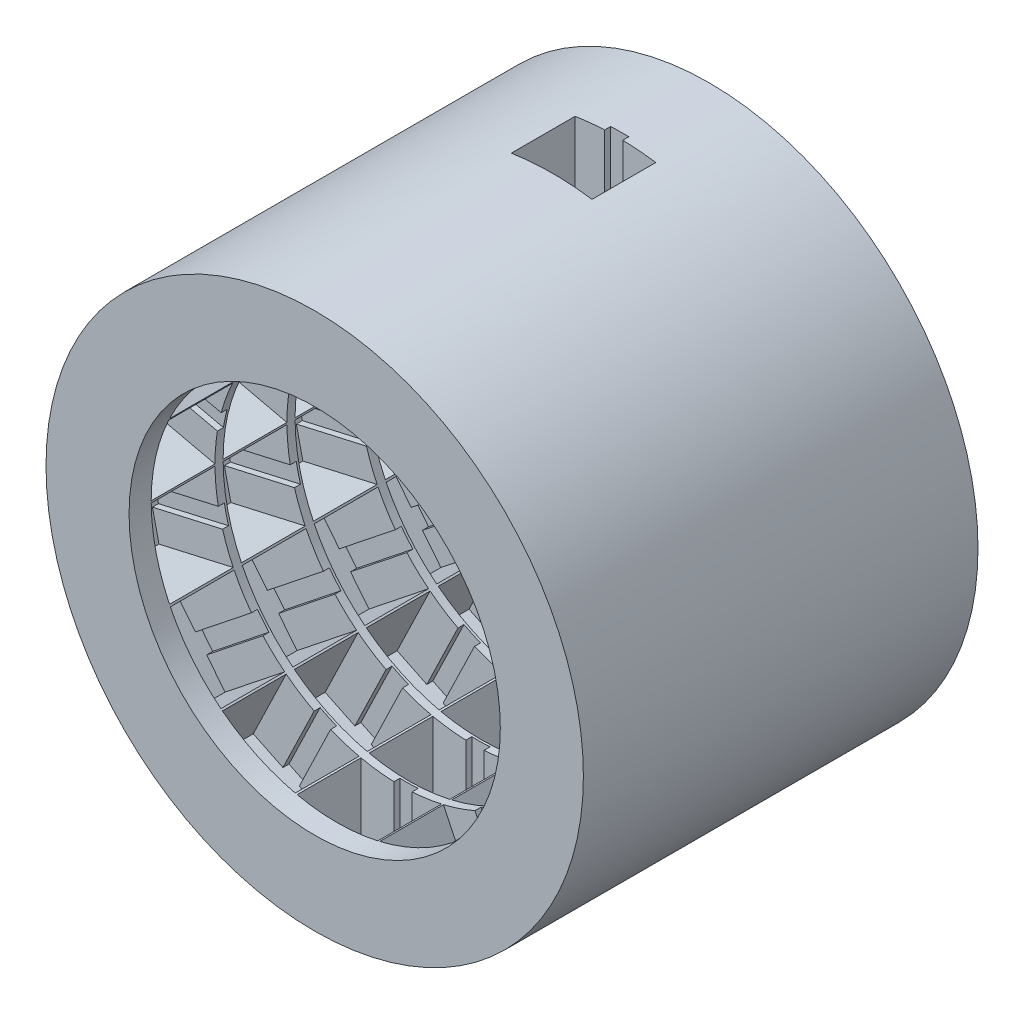
from build123d import *

# Parameters (mm, degrees)
SKETCH1_R               = 2054.325949891
SKETCH1_R_2             = 1419.272954059
BOSS_EXTRUDE1_DEPTH     = 3017
CUT_EXTRUDE1_DEPTH      = 769
CIRPATTERN1_COUNT       = 14
CIRPATTERN1_ANGLE       = 334.1
LPATTERN1_COUNT         = 2
LPATTERN1_PITCH         = 550
LPATTERN1_COPY_1_DEPTH  = 769
LPATTERN1_COPY_2_DEPTH  = 769
LPATTERN1_COPY_3_DEPTH  = 769
LPATTERN1_COPY_4_DEPTH  = 769
LPATTERN1_COPY_5_DEPTH  = 769
LPATTERN1_COPY_6_DEPTH  = 769
LPATTERN1_COPY_7_DEPTH  = 769
LPATTERN1_COPY_8_DEPTH  = 769
LPATTERN1_COPY_9_DEPTH  = 769
LPATTERN1_COPY_10_DEPTH = 769
LPATTERN1_COPY_11_DEPTH = 769
LPATTERN1_COPY_12_DEPTH = 769
LPATTERN1_COPY_13_DEPTH = 769
LPATTERN2_COUNT         = 4
LPATTERN2_PITCH         = 550
LPATTERN2_COPY_1_DEPTH  = 769
LPATTERN2_COPY_2_DEPTH  = 769
LPATTERN2_COPY_3_DEPTH  = 769
LPATTERN2_COPY_4_DEPTH  = 769
LPATTERN2_COPY_5_DEPTH  = 769
LPATTERN2_COPY_6_DEPTH  = 769
LPATTERN2_COPY_7_DEPTH  = 769
LPATTERN2_COPY_8_DEPTH  = 769
LPATTERN2_COPY_9_DEPTH  = 769
LPATTERN2_COPY_10_DEPTH = 769
LPATTERN2_COPY_11_DEPTH = 769
LPATTERN2_COPY_12_DEPTH = 769
LPATTERN2_COPY_13_DEPTH = 769
LPATTERN2_COPY_14_DEPTH = 769
LPATTERN2_COPY_15_DEPTH = 769
LPATTERN2_COPY_16_DEPTH = 769
LPATTERN2_COPY_17_DEPTH = 769
LPATTERN2_COPY_18_DEPTH = 769
LPATTERN2_COPY_19_DEPTH = 769
LPATTERN2_COPY_20_DEPTH = 769
LPATTERN2_COPY_21_DEPTH = 769
LPATTERN2_COPY_22_DEPTH = 769
LPATTERN2_COPY_23_DEPTH = 769
LPATTERN2_COPY_24_DEPTH = 769
LPATTERN2_COPY_25_DEPTH = 769
LPATTERN2_COPY_26_DEPTH = 769
LPATTERN2_COPY_27_DEPTH = 769
LPATTERN2_COPY_28_DEPTH = 769
LPATTERN2_COPY_29_DEPTH = 769
LPATTERN2_COPY_30_DEPTH = 769
LPATTERN2_COPY_31_DEPTH = 769
LPATTERN2_COPY_32_DEPTH = 769
LPATTERN2_COPY_33_DEPTH = 769
LPATTERN2_COPY_34_DEPTH = 769
LPATTERN2_COPY_35_DEPTH = 769
LPATTERN2_COPY_36_DEPTH = 769
LPATTERN2_COPY_37_DEPTH = 769
LPATTERN2_COPY_38_DEPTH = 769
LPATTERN2_COPY_39_DEPTH = 769
CUT_EXTRUDE4_DEPTH      = 1203


with BuildPart() as part:
    # Sketch1 → Boss-Extrude1 (new body)
    with BuildSketch(Plane.XY.offset(943.510776168)):
        with Locations((833.930631376, -1197.16637306)):
            Circle(SKETCH1_R)
        with Locations((833.930631376, -1197.16637306)):
            Circle(SKETCH1_R_2, mode=Mode.SUBTRACT)
    extrude(amount=BOSS_EXTRUDE1_DEPTH)

    # Sketch2 → Cut-Extrude1 (cut)
    with BuildSketch(Plane(origin=(0, 0, 0), x_dir=(1, 0, 0), z_dir=(0, 1, 0))):
        Polygon((1134.867510242, -1653.688224658), (882.617138286, -1653.688224658), (882.617138286, -1607.727014975), (743.684190589, -1607.727014975), (743.684190589, -1653.688224658), (518.159541103, -1653.688224658), (518.159541103, -2141.409900314), (1134.867510242, -2141.409900314), align=None)
    cut_extrude1 = extrude(amount=CUT_EXTRUDE1_DEPTH, mode=Mode.SUBTRACT)

    # CirPattern1: Cut-Extrude1 ×14 about axis
    cirpattern1_axis = Axis((833.930631376, -1197.16637306, 0), (0, 0, 1))
    for i in range(1, CIRPATTERN1_COUNT):
        add(cut_extrude1.rotate(cirpattern1_axis, i * CIRPATTERN1_ANGLE / (CIRPATTERN1_COUNT - 1)), mode=Mode.SUBTRACT)

    # LPattern1: Cut-Extrude1 ×2
    with Locations(*[(0, 0, -i * LPATTERN1_PITCH) for i in range(1, LPATTERN1_COUNT)]):
        add(cut_extrude1, mode=Mode.SUBTRACT)

    # LPattern1 copy 1 sketch → LPattern1 copy 1 (cut)
    with BuildSketch(Plane(origin=(-436.667171374, -480.068857808, -550), x_dir=(0.9010770213220912, 0.4336590845875451, 0), z_dir=(-0.4336590845875451, 0.9010770213220912, 0))):
        Polygon((1134.867510242, -1653.688224658), (882.617138286, -1653.688224658), (882.617138286, -1607.727014975), (743.684190589, -1607.727014975), (743.684190589, -1653.688224658), (518.159541103, -1653.688224658), (518.159541103, -2141.409900314), (1134.867510242, -2141.409900314), align=None)
    extrude(amount=LPATTERN1_COPY_1_DEPTH, mode=Mode.SUBTRACT)

    # LPattern1 copy 2 sketch → LPattern1 copy 2 (cut)
    with BuildSketch(Plane(origin=(-621.951704048, -1102.012560039, -550), x_dir=(0.6238795967093848, 0.7815204724188198, 0), z_dir=(-0.7815204724188198, 0.6238795967093848, 0))):
        Polygon((1134.867510242, -1653.688224658), (882.617138286, -1653.688224658), (882.617138286, -1607.727014975), (743.684190589, -1607.727014975), (743.684190589, -1653.688224658), (518.159541103, -1653.688224658), (518.159541103, -2141.409900314), (1134.867510242, -2141.409900314), align=None)
    extrude(amount=LPATTERN1_COPY_2_DEPTH, mode=Mode.SUBTRACT)

    # LPattern1 copy 3 sketch → LPattern1 copy 3 (cut)
    with BuildSketch(Plane(origin=(-519.195802274, -1742.782059502, -550), x_dir=(0.2232501160109486, 0.9747611941912224, 0), z_dir=(-0.9747611941912224, 0.2232501160109486, 0))):
        Polygon((1134.867510242, -1653.688224658), (882.617138286, -1653.688224658), (882.617138286, -1607.727014975), (743.684190589, -1607.727014975), (743.684190589, -1653.688224658), (518.159541103, -1653.688224658), (518.159541103, -2141.409900314), (1134.867510242, -2141.409900314), align=None)
    extrude(amount=LPATTERN1_COPY_3_DEPTH, mode=Mode.SUBTRACT)

    # LPattern1 copy 4 sketch → LPattern1 copy 4 (cut)
    with BuildSketch(Plane(origin=(-148.72930581, -2275.603701134, -550), x_dir=(-0.2215484976194708, 0.9751493543055625, 0), z_dir=(-0.9751493543055625, -0.2215484976194708, 0))):
        Polygon((1134.867510242, -1653.688224658), (882.617138286, -1653.688224658), (882.617138286, -1607.727014975), (743.684190589, -1607.727014975), (743.684190589, -1653.688224658), (518.159541103, -1653.688224658), (518.159541103, -2141.409900314), (1134.867510242, -2141.409900314), align=None)
    extrude(amount=LPATTERN1_COPY_4_DEPTH, mode=Mode.SUBTRACT)

    # LPattern1 copy 5 sketch → LPattern1 copy 5 (cut)
    with BuildSketch(Plane(origin=(416.152486681, -2595.060877144, -550), x_dir=(-0.622514636637623, 0.7826081568524113, 0), z_dir=(-0.7826081568524113, -0.622514636637623, 0))):
        Polygon((1134.867510242, -1653.688224658), (882.617138286, -1653.688224658), (882.617138286, -1607.727014975), (743.684190589, -1607.727014975), (743.684190589, -1653.688224658), (518.159541103, -1653.688224658), (518.159541103, -2141.409900314), (1134.867510242, -2141.409900314), align=None)
    extrude(amount=LPATTERN1_COPY_5_DEPTH, mode=Mode.SUBTRACT)

    # LPattern1 copy 6 sketch → LPattern1 copy 6 (cut)
    with BuildSketch(Plane(origin=(1063.689996172, -2637.950276712, -550), x_dir=(-0.900318771402196, 0.43523109937232235, 0), z_dir=(-0.43523109937232235, -0.900318771402196, 0))):
        Polygon((1134.867510242, -1653.688224658), (882.617138286, -1653.688224658), (882.617138286, -1607.727014975), (743.684190589, -1607.727014975), (743.684190589, -1653.688224658), (518.159541103, -1653.688224658), (518.159541103, -2141.409900314), (1134.867510242, -2141.409900314), align=None)
    extrude(amount=LPATTERN1_COPY_6_DEPTH, mode=Mode.SUBTRACT)

    # LPattern1 copy 7 sketch → LPattern1 copy 7 (cut)
    with BuildSketch(Plane(origin=(1665.770544173, -2395.786405518, -550), x_dir=(-0.9999984769132877, 0.0017453283658916614, 0), z_dir=(-0.0017453283658916614, -0.9999984769132877, 0))):
        Polygon((1134.867510242, -1653.688224658), (882.617138286, -1653.688224658), (882.617138286, -1607.727014975), (743.684190589, -1607.727014975), (743.684190589, -1653.688224658), (518.159541103, -1653.688224658), (518.159541103, -2141.409900314), (1134.867510242, -2141.409900314), align=None)
    extrude(amount=LPATTERN1_COPY_7_DEPTH, mode=Mode.SUBTRACT)

    # LPattern1 copy 8 sketch → LPattern1 copy 8 (cut)
    with BuildSketch(Plane(origin=(2103.27492826, -1916.480406497, -550), x_dir=(-0.9018325264051107, -0.43208574880198874, 0), z_dir=(0.43208574880198874, -0.9018325264051107, 0))):
        Polygon((1134.867510242, -1653.688224658), (882.617138286, -1653.688224658), (882.617138286, -1607.727014975), (743.684190589, -1607.727014975), (743.684190589, -1653.688224658), (518.159541103, -1653.688224658), (518.159541103, -2141.409900314), (1134.867510242, -2141.409900314), align=None)
    extrude(amount=LPATTERN1_COPY_8_DEPTH, mode=Mode.SUBTRACT)

    # LPattern1 copy 9 sketch → LPattern1 copy 9 (cut)
    with BuildSketch(Plane(origin=(2289.644674716, -1294.861033892, -550), x_dir=(-0.6252426563356989, -0.7804304073383348, 0), z_dir=(0.7804304073383348, -0.6252426563356989, 0))):
        Polygon((1134.867510242, -1653.688224658), (882.617138286, -1653.688224658), (882.617138286, -1607.727014975), (743.684190589, -1607.727014975), (743.684190589, -1653.688224658), (518.159541103, -1653.688224658), (518.159541103, -2141.409900314), (1134.867510242, -2141.409900314), align=None)
    extrude(amount=LPATTERN1_COPY_9_DEPTH, mode=Mode.SUBTRACT)

    # LPattern1 copy 10 sketch → LPattern1 copy 10 (cut)
    with BuildSketch(Plane(origin=(2188.00728263, -653.913167585, -550), x_dir=(-0.22495105434385662, -0.9743700647852371, 0), z_dir=(0.9743700647852371, -0.22495105434385662, 0))):
        Polygon((1134.867510242, -1653.688224658), (882.617138286, -1653.688224658), (882.617138286, -1607.727014975), (743.684190589, -1607.727014975), (743.684190589, -1653.688224658), (518.159541103, -1653.688224658), (518.159541103, -2141.409900314), (1134.867510242, -2141.409900314), align=None)
    extrude(amount=LPATTERN1_COPY_10_DEPTH, mode=Mode.SUBTRACT)

    # LPattern1 copy 11 sketch → LPattern1 copy 11 (cut)
    with BuildSketch(Plane(origin=(1818.471299145, -120.445751803, -550), x_dir=(0.2198462043528473, -0.9755345439458544, 0), z_dir=(0.9755345439458544, 0.2198462043528473, 0))):
        Polygon((1134.867510242, -1653.688224658), (882.617138286, -1653.688224658), (882.617138286, -1607.727014975), (743.684190589, -1607.727014975), (743.684190589, -1653.688224658), (518.159541103, -1653.688224658), (518.159541103, -2141.409900314), (1134.867510242, -2141.409900314), align=None)
    extrude(amount=LPATTERN1_COPY_11_DEPTH, mode=Mode.SUBTRACT)

    # LPattern1 copy 12 sketch → LPattern1 copy 12 (cut)
    with BuildSketch(Plane(origin=(1254.147924688, 199.996841863, -550), x_dir=(0.6211477802783193, -0.7836934573258327, 0), z_dir=(0.7836934573258327, 0.6211477802783193, 0))):
        Polygon((1134.867510242, -1653.688224658), (882.617138286, -1653.688224658), (882.617138286, -1607.727014975), (743.684190589, -1607.727014975), (743.684190589, -1653.688224658), (518.159541103, -1653.688224658), (518.159541103, -2141.409900314), (1134.867510242, -2141.409900314), align=None)
    extrude(amount=LPATTERN1_COPY_12_DEPTH, mode=Mode.SUBTRACT)

    # LPattern1 copy 13 sketch → LPattern1 copy 13 (cut)
    with BuildSketch(Plane(origin=(606.686257539, 244.016341689, -550), x_dir=(0.8995577789551855, -0.4368017883676915, 0), z_dir=(0.4368017883676915, 0.8995577789551855, 0))):
        Polygon((1134.867510242, -1653.688224658), (882.617138286, -1653.688224658), (882.617138286, -1607.727014975), (743.684190589, -1607.727014975), (743.684190589, -1653.688224658), (518.159541103, -1653.688224658), (518.159541103, -2141.409900314), (1134.867510242, -2141.409900314), align=None)
    extrude(amount=LPATTERN1_COPY_13_DEPTH, mode=Mode.SUBTRACT)

    # LPattern2: Cut-Extrude1 ×4
    with Locations(*[(0, 0, i * LPATTERN2_PITCH) for i in range(1, LPATTERN2_COUNT)]):
        add(cut_extrude1, mode=Mode.SUBTRACT)

    # LPattern2 copy 1 sketch → LPattern2 copy 1 (cut)
    with BuildSketch(Plane(origin=(-436.667171374, -480.068857808, 550), x_dir=(0.9010770213220912, 0.4336590845875451, 0), z_dir=(-0.4336590845875451, 0.9010770213220912, 0))):
        Polygon((1134.867510242, -1653.688224658), (882.617138286, -1653.688224658), (882.617138286, -1607.727014975), (743.684190589, -1607.727014975), (743.684190589, -1653.688224658), (518.159541103, -1653.688224658), (518.159541103, -2141.409900314), (1134.867510242, -2141.409900314), align=None)
    extrude(amount=LPATTERN2_COPY_1_DEPTH, mode=Mode.SUBTRACT)

    # LPattern2 copy 2 sketch → LPattern2 copy 2 (cut)
    with BuildSketch(Plane(origin=(-436.667171374, -480.068857808, 1100), x_dir=(0.9010770213220912, 0.4336590845875451, 0), z_dir=(-0.4336590845875451, 0.9010770213220912, 0))):
        Polygon((1134.867510242, -1653.688224658), (882.617138286, -1653.688224658), (882.617138286, -1607.727014975), (743.684190589, -1607.727014975), (743.684190589, -1653.688224658), (518.159541103, -1653.688224658), (518.159541103, -2141.409900314), (1134.867510242, -2141.409900314), align=None)
    extrude(amount=LPATTERN2_COPY_2_DEPTH, mode=Mode.SUBTRACT)

    # LPattern2 copy 3 sketch → LPattern2 copy 3 (cut)
    with BuildSketch(Plane(origin=(-436.667171374, -480.068857808, 1650), x_dir=(0.9010770213220912, 0.4336590845875451, 0), z_dir=(-0.4336590845875451, 0.9010770213220912, 0))):
        Polygon((1134.867510242, -1653.688224658), (882.617138286, -1653.688224658), (882.617138286, -1607.727014975), (743.684190589, -1607.727014975), (743.684190589, -1653.688224658), (518.159541103, -1653.688224658), (518.159541103, -2141.409900314), (1134.867510242, -2141.409900314), align=None)
    extrude(amount=LPATTERN2_COPY_3_DEPTH, mode=Mode.SUBTRACT)

    # LPattern2 copy 4 sketch → LPattern2 copy 4 (cut)
    with BuildSketch(Plane(origin=(-621.951704048, -1102.012560039, 550), x_dir=(0.6238795967093848, 0.7815204724188198, 0), z_dir=(-0.7815204724188198, 0.6238795967093848, 0))):
        Polygon((1134.867510242, -1653.688224658), (882.617138286, -1653.688224658), (882.617138286, -1607.727014975), (743.684190589, -1607.727014975), (743.684190589, -1653.688224658), (518.159541103, -1653.688224658), (518.159541103, -2141.409900314), (1134.867510242, -2141.409900314), align=None)
    extrude(amount=LPATTERN2_COPY_4_DEPTH, mode=Mode.SUBTRACT)

    # LPattern2 copy 5 sketch → LPattern2 copy 5 (cut)
    with BuildSketch(Plane(origin=(-621.951704048, -1102.012560039, 1100), x_dir=(0.6238795967093848, 0.7815204724188198, 0), z_dir=(-0.7815204724188198, 0.6238795967093848, 0))):
        Polygon((1134.867510242, -1653.688224658), (882.617138286, -1653.688224658), (882.617138286, -1607.727014975), (743.684190589, -1607.727014975), (743.684190589, -1653.688224658), (518.159541103, -1653.688224658), (518.159541103, -2141.409900314), (1134.867510242, -2141.409900314), align=None)
    extrude(amount=LPATTERN2_COPY_5_DEPTH, mode=Mode.SUBTRACT)

    # LPattern2 copy 6 sketch → LPattern2 copy 6 (cut)
    with BuildSketch(Plane(origin=(-621.951704048, -1102.012560039, 1650), x_dir=(0.6238795967093848, 0.7815204724188198, 0), z_dir=(-0.7815204724188198, 0.6238795967093848, 0))):
        Polygon((1134.867510242, -1653.688224658), (882.617138286, -1653.688224658), (882.617138286, -1607.727014975), (743.684190589, -1607.727014975), (743.684190589, -1653.688224658), (518.159541103, -1653.688224658), (518.159541103, -2141.409900314), (1134.867510242, -2141.409900314), align=None)
    extrude(amount=LPATTERN2_COPY_6_DEPTH, mode=Mode.SUBTRACT)

    # LPattern2 copy 7 sketch → LPattern2 copy 7 (cut)
    with BuildSketch(Plane(origin=(-519.195802274, -1742.782059502, 550), x_dir=(0.2232501160109486, 0.9747611941912224, 0), z_dir=(-0.9747611941912224, 0.2232501160109486, 0))):
        Polygon((1134.867510242, -1653.688224658), (882.617138286, -1653.688224658), (882.617138286, -1607.727014975), (743.684190589, -1607.727014975), (743.684190589, -1653.688224658), (518.159541103, -1653.688224658), (518.159541103, -2141.409900314), (1134.867510242, -2141.409900314), align=None)
    extrude(amount=LPATTERN2_COPY_7_DEPTH, mode=Mode.SUBTRACT)

    # LPattern2 copy 8 sketch → LPattern2 copy 8 (cut)
    with BuildSketch(Plane(origin=(-519.195802274, -1742.782059502, 1100), x_dir=(0.2232501160109486, 0.9747611941912224, 0), z_dir=(-0.9747611941912224, 0.2232501160109486, 0))):
        Polygon((1134.867510242, -1653.688224658), (882.617138286, -1653.688224658), (882.617138286, -1607.727014975), (743.684190589, -1607.727014975), (743.684190589, -1653.688224658), (518.159541103, -1653.688224658), (518.159541103, -2141.409900314), (1134.867510242, -2141.409900314), align=None)
    extrude(amount=LPATTERN2_COPY_8_DEPTH, mode=Mode.SUBTRACT)

    # LPattern2 copy 9 sketch → LPattern2 copy 9 (cut)
    with BuildSketch(Plane(origin=(-519.195802274, -1742.782059502, 1650), x_dir=(0.2232501160109486, 0.9747611941912224, 0), z_dir=(-0.9747611941912224, 0.2232501160109486, 0))):
        Polygon((1134.867510242, -1653.688224658), (882.617138286, -1653.688224658), (882.617138286, -1607.727014975), (743.684190589, -1607.727014975), (743.684190589, -1653.688224658), (518.159541103, -1653.688224658), (518.159541103, -2141.409900314), (1134.867510242, -2141.409900314), align=None)
    extrude(amount=LPATTERN2_COPY_9_DEPTH, mode=Mode.SUBTRACT)

    # LPattern2 copy 10 sketch → LPattern2 copy 10 (cut)
    with BuildSketch(Plane(origin=(-148.72930581, -2275.603701134, 550), x_dir=(-0.2215484976194708, 0.9751493543055625, 0), z_dir=(-0.9751493543055625, -0.2215484976194708, 0))):
        Polygon((1134.867510242, -1653.688224658), (882.617138286, -1653.688224658), (882.617138286, -1607.727014975), (743.684190589, -1607.727014975), (743.684190589, -1653.688224658), (518.159541103, -1653.688224658), (518.159541103, -2141.409900314), (1134.867510242, -2141.409900314), align=None)
    extrude(amount=LPATTERN2_COPY_10_DEPTH, mode=Mode.SUBTRACT)

    # LPattern2 copy 11 sketch → LPattern2 copy 11 (cut)
    with BuildSketch(Plane(origin=(-148.72930581, -2275.603701134, 1100), x_dir=(-0.2215484976194708, 0.9751493543055625, 0), z_dir=(-0.9751493543055625, -0.2215484976194708, 0))):
        Polygon((1134.867510242, -1653.688224658), (882.617138286, -1653.688224658), (882.617138286, -1607.727014975), (743.684190589, -1607.727014975), (743.684190589, -1653.688224658), (518.159541103, -1653.688224658), (518.159541103, -2141.409900314), (1134.867510242, -2141.409900314), align=None)
    extrude(amount=LPATTERN2_COPY_11_DEPTH, mode=Mode.SUBTRACT)

    # LPattern2 copy 12 sketch → LPattern2 copy 12 (cut)
    with BuildSketch(Plane(origin=(-148.72930581, -2275.603701134, 1650), x_dir=(-0.2215484976194708, 0.9751493543055625, 0), z_dir=(-0.9751493543055625, -0.2215484976194708, 0))):
        Polygon((1134.867510242, -1653.688224658), (882.617138286, -1653.688224658), (882.617138286, -1607.727014975), (743.684190589, -1607.727014975), (743.684190589, -1653.688224658), (518.159541103, -1653.688224658), (518.159541103, -2141.409900314), (1134.867510242, -2141.409900314), align=None)
    extrude(amount=LPATTERN2_COPY_12_DEPTH, mode=Mode.SUBTRACT)

    # LPattern2 copy 13 sketch → LPattern2 copy 13 (cut)
    with BuildSketch(Plane(origin=(416.152486681, -2595.060877144, 550), x_dir=(-0.622514636637623, 0.7826081568524113, 0), z_dir=(-0.7826081568524113, -0.622514636637623, 0))):
        Polygon((1134.867510242, -1653.688224658), (882.617138286, -1653.688224658), (882.617138286, -1607.727014975), (743.684190589, -1607.727014975), (743.684190589, -1653.688224658), (518.159541103, -1653.688224658), (518.159541103, -2141.409900314), (1134.867510242, -2141.409900314), align=None)
    extrude(amount=LPATTERN2_COPY_13_DEPTH, mode=Mode.SUBTRACT)

    # LPattern2 copy 14 sketch → LPattern2 copy 14 (cut)
    with BuildSketch(Plane(origin=(416.152486681, -2595.060877144, 1100), x_dir=(-0.622514636637623, 0.7826081568524113, 0), z_dir=(-0.7826081568524113, -0.622514636637623, 0))):
        Polygon((1134.867510242, -1653.688224658), (882.617138286, -1653.688224658), (882.617138286, -1607.727014975), (743.684190589, -1607.727014975), (743.684190589, -1653.688224658), (518.159541103, -1653.688224658), (518.159541103, -2141.409900314), (1134.867510242, -2141.409900314), align=None)
    extrude(amount=LPATTERN2_COPY_14_DEPTH, mode=Mode.SUBTRACT)

    # LPattern2 copy 15 sketch → LPattern2 copy 15 (cut)
    with BuildSketch(Plane(origin=(416.152486681, -2595.060877144, 1650), x_dir=(-0.622514636637623, 0.7826081568524113, 0), z_dir=(-0.7826081568524113, -0.622514636637623, 0))):
        Polygon((1134.867510242, -1653.688224658), (882.617138286, -1653.688224658), (882.617138286, -1607.727014975), (743.684190589, -1607.727014975), (743.684190589, -1653.688224658), (518.159541103, -1653.688224658), (518.159541103, -2141.409900314), (1134.867510242, -2141.409900314), align=None)
    extrude(amount=LPATTERN2_COPY_15_DEPTH, mode=Mode.SUBTRACT)

    # LPattern2 copy 16 sketch → LPattern2 copy 16 (cut)
    with BuildSketch(Plane(origin=(1063.689996172, -2637.950276712, 550), x_dir=(-0.900318771402196, 0.43523109937232235, 0), z_dir=(-0.43523109937232235, -0.900318771402196, 0))):
        Polygon((1134.867510242, -1653.688224658), (882.617138286, -1653.688224658), (882.617138286, -1607.727014975), (743.684190589, -1607.727014975), (743.684190589, -1653.688224658), (518.159541103, -1653.688224658), (518.159541103, -2141.409900314), (1134.867510242, -2141.409900314), align=None)
    extrude(amount=LPATTERN2_COPY_16_DEPTH, mode=Mode.SUBTRACT)

    # LPattern2 copy 17 sketch → LPattern2 copy 17 (cut)
    with BuildSketch(Plane(origin=(1063.689996172, -2637.950276712, 1100), x_dir=(-0.900318771402196, 0.43523109937232235, 0), z_dir=(-0.43523109937232235, -0.900318771402196, 0))):
        Polygon((1134.867510242, -1653.688224658), (882.617138286, -1653.688224658), (882.617138286, -1607.727014975), (743.684190589, -1607.727014975), (743.684190589, -1653.688224658), (518.159541103, -1653.688224658), (518.159541103, -2141.409900314), (1134.867510242, -2141.409900314), align=None)
    extrude(amount=LPATTERN2_COPY_17_DEPTH, mode=Mode.SUBTRACT)

    # LPattern2 copy 18 sketch → LPattern2 copy 18 (cut)
    with BuildSketch(Plane(origin=(1063.689996172, -2637.950276712, 1650), x_dir=(-0.900318771402196, 0.43523109937232235, 0), z_dir=(-0.43523109937232235, -0.900318771402196, 0))):
        Polygon((1134.867510242, -1653.688224658), (882.617138286, -1653.688224658), (882.617138286, -1607.727014975), (743.684190589, -1607.727014975), (743.684190589, -1653.688224658), (518.159541103, -1653.688224658), (518.159541103, -2141.409900314), (1134.867510242, -2141.409900314), align=None)
    extrude(amount=LPATTERN2_COPY_18_DEPTH, mode=Mode.SUBTRACT)

    # LPattern2 copy 19 sketch → LPattern2 copy 19 (cut)
    with BuildSketch(Plane(origin=(1665.770544173, -2395.786405518, 550), x_dir=(-0.9999984769132877, 0.0017453283658916614, 0), z_dir=(-0.0017453283658916614, -0.9999984769132877, 0))):
        Polygon((1134.867510242, -1653.688224658), (882.617138286, -1653.688224658), (882.617138286, -1607.727014975), (743.684190589, -1607.727014975), (743.684190589, -1653.688224658), (518.159541103, -1653.688224658), (518.159541103, -2141.409900314), (1134.867510242, -2141.409900314), align=None)
    extrude(amount=LPATTERN2_COPY_19_DEPTH, mode=Mode.SUBTRACT)

    # LPattern2 copy 20 sketch → LPattern2 copy 20 (cut)
    with BuildSketch(Plane(origin=(1665.770544173, -2395.786405518, 1100), x_dir=(-0.9999984769132877, 0.0017453283658916614, 0), z_dir=(-0.0017453283658916614, -0.9999984769132877, 0))):
        Polygon((1134.867510242, -1653.688224658), (882.617138286, -1653.688224658), (882.617138286, -1607.727014975), (743.684190589, -1607.727014975), (743.684190589, -1653.688224658), (518.159541103, -1653.688224658), (518.159541103, -2141.409900314), (1134.867510242, -2141.409900314), align=None)
    extrude(amount=LPATTERN2_COPY_20_DEPTH, mode=Mode.SUBTRACT)

    # LPattern2 copy 21 sketch → LPattern2 copy 21 (cut)
    with BuildSketch(Plane(origin=(1665.770544173, -2395.786405518, 1650), x_dir=(-0.9999984769132877, 0.0017453283658916614, 0), z_dir=(-0.0017453283658916614, -0.9999984769132877, 0))):
        Polygon((1134.867510242, -1653.688224658), (882.617138286, -1653.688224658), (882.617138286, -1607.727014975), (743.684190589, -1607.727014975), (743.684190589, -1653.688224658), (518.159541103, -1653.688224658), (518.159541103, -2141.409900314), (1134.867510242, -2141.409900314), align=None)
    extrude(amount=LPATTERN2_COPY_21_DEPTH, mode=Mode.SUBTRACT)

    # LPattern2 copy 22 sketch → LPattern2 copy 22 (cut)
    with BuildSketch(Plane(origin=(2103.27492826, -1916.480406497, 550), x_dir=(-0.9018325264051107, -0.43208574880198874, 0), z_dir=(0.43208574880198874, -0.9018325264051107, 0))):
        Polygon((1134.867510242, -1653.688224658), (882.617138286, -1653.688224658), (882.617138286, -1607.727014975), (743.684190589, -1607.727014975), (743.684190589, -1653.688224658), (518.159541103, -1653.688224658), (518.159541103, -2141.409900314), (1134.867510242, -2141.409900314), align=None)
    extrude(amount=LPATTERN2_COPY_22_DEPTH, mode=Mode.SUBTRACT)

    # LPattern2 copy 23 sketch → LPattern2 copy 23 (cut)
    with BuildSketch(Plane(origin=(2103.27492826, -1916.480406497, 1100), x_dir=(-0.9018325264051107, -0.43208574880198874, 0), z_dir=(0.43208574880198874, -0.9018325264051107, 0))):
        Polygon((1134.867510242, -1653.688224658), (882.617138286, -1653.688224658), (882.617138286, -1607.727014975), (743.684190589, -1607.727014975), (743.684190589, -1653.688224658), (518.159541103, -1653.688224658), (518.159541103, -2141.409900314), (1134.867510242, -2141.409900314), align=None)
    extrude(amount=LPATTERN2_COPY_23_DEPTH, mode=Mode.SUBTRACT)

    # LPattern2 copy 24 sketch → LPattern2 copy 24 (cut)
    with BuildSketch(Plane(origin=(2103.27492826, -1916.480406497, 1650), x_dir=(-0.9018325264051107, -0.43208574880198874, 0), z_dir=(0.43208574880198874, -0.9018325264051107, 0))):
        Polygon((1134.867510242, -1653.688224658), (882.617138286, -1653.688224658), (882.617138286, -1607.727014975), (743.684190589, -1607.727014975), (743.684190589, -1653.688224658), (518.159541103, -1653.688224658), (518.159541103, -2141.409900314), (1134.867510242, -2141.409900314), align=None)
    extrude(amount=LPATTERN2_COPY_24_DEPTH, mode=Mode.SUBTRACT)

    # LPattern2 copy 25 sketch → LPattern2 copy 25 (cut)
    with BuildSketch(Plane(origin=(2289.644674716, -1294.861033892, 550), x_dir=(-0.6252426563356989, -0.7804304073383348, 0), z_dir=(0.7804304073383348, -0.6252426563356989, 0))):
        Polygon((1134.867510242, -1653.688224658), (882.617138286, -1653.688224658), (882.617138286, -1607.727014975), (743.684190589, -1607.727014975), (743.684190589, -1653.688224658), (518.159541103, -1653.688224658), (518.159541103, -2141.409900314), (1134.867510242, -2141.409900314), align=None)
    extrude(amount=LPATTERN2_COPY_25_DEPTH, mode=Mode.SUBTRACT)

    # LPattern2 copy 26 sketch → LPattern2 copy 26 (cut)
    with BuildSketch(Plane(origin=(2289.644674716, -1294.861033892, 1100), x_dir=(-0.6252426563356989, -0.7804304073383348, 0), z_dir=(0.7804304073383348, -0.6252426563356989, 0))):
        Polygon((1134.867510242, -1653.688224658), (882.617138286, -1653.688224658), (882.617138286, -1607.727014975), (743.684190589, -1607.727014975), (743.684190589, -1653.688224658), (518.159541103, -1653.688224658), (518.159541103, -2141.409900314), (1134.867510242, -2141.409900314), align=None)
    extrude(amount=LPATTERN2_COPY_26_DEPTH, mode=Mode.SUBTRACT)

    # LPattern2 copy 27 sketch → LPattern2 copy 27 (cut)
    with BuildSketch(Plane(origin=(2289.644674716, -1294.861033892, 1650), x_dir=(-0.6252426563356989, -0.7804304073383348, 0), z_dir=(0.7804304073383348, -0.6252426563356989, 0))):
        Polygon((1134.867510242, -1653.688224658), (882.617138286, -1653.688224658), (882.617138286, -1607.727014975), (743.684190589, -1607.727014975), (743.684190589, -1653.688224658), (518.159541103, -1653.688224658), (518.159541103, -2141.409900314), (1134.867510242, -2141.409900314), align=None)
    extrude(amount=LPATTERN2_COPY_27_DEPTH, mode=Mode.SUBTRACT)

    # LPattern2 copy 28 sketch → LPattern2 copy 28 (cut)
    with BuildSketch(Plane(origin=(2188.00728263, -653.913167585, 550), x_dir=(-0.22495105434385662, -0.9743700647852371, 0), z_dir=(0.9743700647852371, -0.22495105434385662, 0))):
        Polygon((1134.867510242, -1653.688224658), (882.617138286, -1653.688224658), (882.617138286, -1607.727014975), (743.684190589, -1607.727014975), (743.684190589, -1653.688224658), (518.159541103, -1653.688224658), (518.159541103, -2141.409900314), (1134.867510242, -2141.409900314), align=None)
    extrude(amount=LPATTERN2_COPY_28_DEPTH, mode=Mode.SUBTRACT)

    # LPattern2 copy 29 sketch → LPattern2 copy 29 (cut)
    with BuildSketch(Plane(origin=(2188.00728263, -653.913167585, 1100), x_dir=(-0.22495105434385662, -0.9743700647852371, 0), z_dir=(0.9743700647852371, -0.22495105434385662, 0))):
        Polygon((1134.867510242, -1653.688224658), (882.617138286, -1653.688224658), (882.617138286, -1607.727014975), (743.684190589, -1607.727014975), (743.684190589, -1653.688224658), (518.159541103, -1653.688224658), (518.159541103, -2141.409900314), (1134.867510242, -2141.409900314), align=None)
    extrude(amount=LPATTERN2_COPY_29_DEPTH, mode=Mode.SUBTRACT)

    # LPattern2 copy 30 sketch → LPattern2 copy 30 (cut)
    with BuildSketch(Plane(origin=(2188.00728263, -653.913167585, 1650), x_dir=(-0.22495105434385662, -0.9743700647852371, 0), z_dir=(0.9743700647852371, -0.22495105434385662, 0))):
        Polygon((1134.867510242, -1653.688224658), (882.617138286, -1653.688224658), (882.617138286, -1607.727014975), (743.684190589, -1607.727014975), (743.684190589, -1653.688224658), (518.159541103, -1653.688224658), (518.159541103, -2141.409900314), (1134.867510242, -2141.409900314), align=None)
    extrude(amount=LPATTERN2_COPY_30_DEPTH, mode=Mode.SUBTRACT)

    # LPattern2 copy 31 sketch → LPattern2 copy 31 (cut)
    with BuildSketch(Plane(origin=(1818.471299145, -120.445751803, 550), x_dir=(0.2198462043528473, -0.9755345439458544, 0), z_dir=(0.9755345439458544, 0.2198462043528473, 0))):
        Polygon((1134.867510242, -1653.688224658), (882.617138286, -1653.688224658), (882.617138286, -1607.727014975), (743.684190589, -1607.727014975), (743.684190589, -1653.688224658), (518.159541103, -1653.688224658), (518.159541103, -2141.409900314), (1134.867510242, -2141.409900314), align=None)
    extrude(amount=LPATTERN2_COPY_31_DEPTH, mode=Mode.SUBTRACT)

    # LPattern2 copy 32 sketch → LPattern2 copy 32 (cut)
    with BuildSketch(Plane(origin=(1818.471299145, -120.445751803, 1100), x_dir=(0.2198462043528473, -0.9755345439458544, 0), z_dir=(0.9755345439458544, 0.2198462043528473, 0))):
        Polygon((1134.867510242, -1653.688224658), (882.617138286, -1653.688224658), (882.617138286, -1607.727014975), (743.684190589, -1607.727014975), (743.684190589, -1653.688224658), (518.159541103, -1653.688224658), (518.159541103, -2141.409900314), (1134.867510242, -2141.409900314), align=None)
    extrude(amount=LPATTERN2_COPY_32_DEPTH, mode=Mode.SUBTRACT)

    # LPattern2 copy 33 sketch → LPattern2 copy 33 (cut)
    with BuildSketch(Plane(origin=(1818.471299145, -120.445751803, 1650), x_dir=(0.2198462043528473, -0.9755345439458544, 0), z_dir=(0.9755345439458544, 0.2198462043528473, 0))):
        Polygon((1134.867510242, -1653.688224658), (882.617138286, -1653.688224658), (882.617138286, -1607.727014975), (743.684190589, -1607.727014975), (743.684190589, -1653.688224658), (518.159541103, -1653.688224658), (518.159541103, -2141.409900314), (1134.867510242, -2141.409900314), align=None)
    extrude(amount=LPATTERN2_COPY_33_DEPTH, mode=Mode.SUBTRACT)

    # LPattern2 copy 34 sketch → LPattern2 copy 34 (cut)
    with BuildSketch(Plane(origin=(1254.147924688, 199.996841863, 550), x_dir=(0.6211477802783193, -0.7836934573258327, 0), z_dir=(0.7836934573258327, 0.6211477802783193, 0))):
        Polygon((1134.867510242, -1653.688224658), (882.617138286, -1653.688224658), (882.617138286, -1607.727014975), (743.684190589, -1607.727014975), (743.684190589, -1653.688224658), (518.159541103, -1653.688224658), (518.159541103, -2141.409900314), (1134.867510242, -2141.409900314), align=None)
    extrude(amount=LPATTERN2_COPY_34_DEPTH, mode=Mode.SUBTRACT)

    # LPattern2 copy 35 sketch → LPattern2 copy 35 (cut)
    with BuildSketch(Plane(origin=(1254.147924688, 199.996841863, 1100), x_dir=(0.6211477802783193, -0.7836934573258327, 0), z_dir=(0.7836934573258327, 0.6211477802783193, 0))):
        Polygon((1134.867510242, -1653.688224658), (882.617138286, -1653.688224658), (882.617138286, -1607.727014975), (743.684190589, -1607.727014975), (743.684190589, -1653.688224658), (518.159541103, -1653.688224658), (518.159541103, -2141.409900314), (1134.867510242, -2141.409900314), align=None)
    extrude(amount=LPATTERN2_COPY_35_DEPTH, mode=Mode.SUBTRACT)

    # LPattern2 copy 36 sketch → LPattern2 copy 36 (cut)
    with BuildSketch(Plane(origin=(1254.147924688, 199.996841863, 1650), x_dir=(0.6211477802783193, -0.7836934573258327, 0), z_dir=(0.7836934573258327, 0.6211477802783193, 0))):
        Polygon((1134.867510242, -1653.688224658), (882.617138286, -1653.688224658), (882.617138286, -1607.727014975), (743.684190589, -1607.727014975), (743.684190589, -1653.688224658), (518.159541103, -1653.688224658), (518.159541103, -2141.409900314), (1134.867510242, -2141.409900314), align=None)
    extrude(amount=LPATTERN2_COPY_36_DEPTH, mode=Mode.SUBTRACT)

    # LPattern2 copy 37 sketch → LPattern2 copy 37 (cut)
    with BuildSketch(Plane(origin=(606.686257539, 244.016341689, 550), x_dir=(0.8995577789551855, -0.4368017883676915, 0), z_dir=(0.4368017883676915, 0.8995577789551855, 0))):
        Polygon((1134.867510242, -1653.688224658), (882.617138286, -1653.688224658), (882.617138286, -1607.727014975), (743.684190589, -1607.727014975), (743.684190589, -1653.688224658), (518.159541103, -1653.688224658), (518.159541103, -2141.409900314), (1134.867510242, -2141.409900314), align=None)
    extrude(amount=LPATTERN2_COPY_37_DEPTH, mode=Mode.SUBTRACT)

    # LPattern2 copy 38 sketch → LPattern2 copy 38 (cut)
    with BuildSketch(Plane(origin=(606.686257539, 244.016341689, 1100), x_dir=(0.8995577789551855, -0.4368017883676915, 0), z_dir=(0.4368017883676915, 0.8995577789551855, 0))):
        Polygon((1134.867510242, -1653.688224658), (882.617138286, -1653.688224658), (882.617138286, -1607.727014975), (743.684190589, -1607.727014975), (743.684190589, -1653.688224658), (518.159541103, -1653.688224658), (518.159541103, -2141.409900314), (1134.867510242, -2141.409900314), align=None)
    extrude(amount=LPATTERN2_COPY_38_DEPTH, mode=Mode.SUBTRACT)

    # LPattern2 copy 39 sketch → LPattern2 copy 39 (cut)
    with BuildSketch(Plane(origin=(606.686257539, 244.016341689, 1650), x_dir=(0.8995577789551855, -0.4368017883676915, 0), z_dir=(0.4368017883676915, 0.8995577789551855, 0))):
        Polygon((1134.867510242, -1653.688224658), (882.617138286, -1653.688224658), (882.617138286, -1607.727014975), (743.684190589, -1607.727014975), (743.684190589, -1653.688224658), (518.159541103, -1653.688224658), (518.159541103, -2141.409900314), (1134.867510242, -2141.409900314), align=None)
    extrude(amount=LPATTERN2_COPY_39_DEPTH, mode=Mode.SUBTRACT)

    # Sketch2<2> → Cut-Extrude4 (cut)
    with BuildSketch(Plane(origin=(0, 0, 0), x_dir=(1, 0, 0), z_dir=(0, 1, 0))):
        Polygon((1134.867510242, -1653.688224658), (882.617138286, -1653.688224658), (882.617138286, -1607.727014975), (743.684190589, -1607.727014975), (743.684190589, -1653.688224658), (518.159541103, -1653.688224658), (518.159541103, -2141.409900314), (1134.867510242, -2141.409900314), align=None)
    extrude(amount=CUT_EXTRUDE4_DEPTH, mode=Mode.SUBTRACT)


solid = part.part
